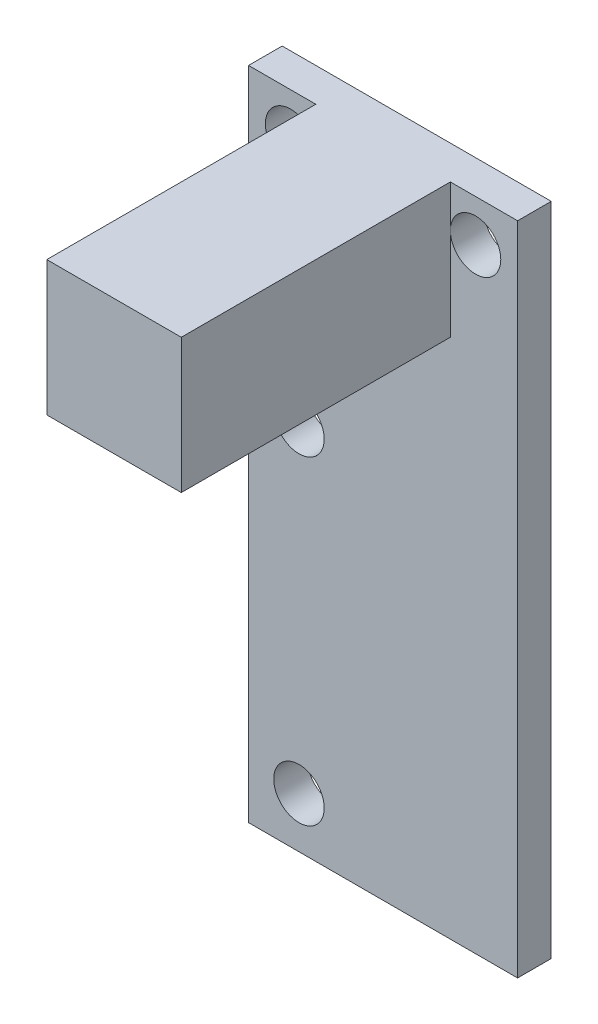
from build123d import *

# Parameters (mm, degrees)
SKETCH1_W           = 16
SKETCH1_H           = 39
BOSS_EXTRUDE1_DEPTH = 2
SKETCH2_W           = 8
SKETCH2_H           = 8
BOSS_EXTRUDE2_DEPTH = 16
HOLE1_D             = 3
HOLE2_D             = 3
HOLE3_D             = 3
HOLE4_D             = 3


with BuildPart() as part:
    # Sketch1 → Boss-Extrude1 (new body)
    with BuildSketch(Plane.XY.offset(2)):
        with Locations((8, 19.5)):
            Rectangle(SKETCH1_W, SKETCH1_H)
    extrude(amount=-BOSS_EXTRUDE1_DEPTH)

    # Sketch2 → Boss-Extrude2 (add)
    with BuildSketch(Plane.XY.offset(2)):
        with Locations((8, 35)):
            Rectangle(SKETCH2_W, SKETCH2_H)
    extrude(amount=BOSS_EXTRUDE2_DEPTH)

    # Hole1 (through all)
    with Locations(Plane.XY.offset(2)):
        with Locations((3, 3)):
            Hole(HOLE1_D / 2)

    # Hole2 (through all)
    with Locations(Plane.XY.offset(2)):
        with Locations((13.5, 36.5)):
            Hole(HOLE2_D / 2)

    # Hole3 (through all)
    with Locations(Plane.XY.offset(2)):
        with Locations((2.5, 36.5)):
            Hole(HOLE3_D / 2)

    # Hole4 (through all)
    with Locations(Plane.XY.offset(2)):
        with Locations((3, 22)):
            Hole(HOLE4_D / 2)


solid = part.part
